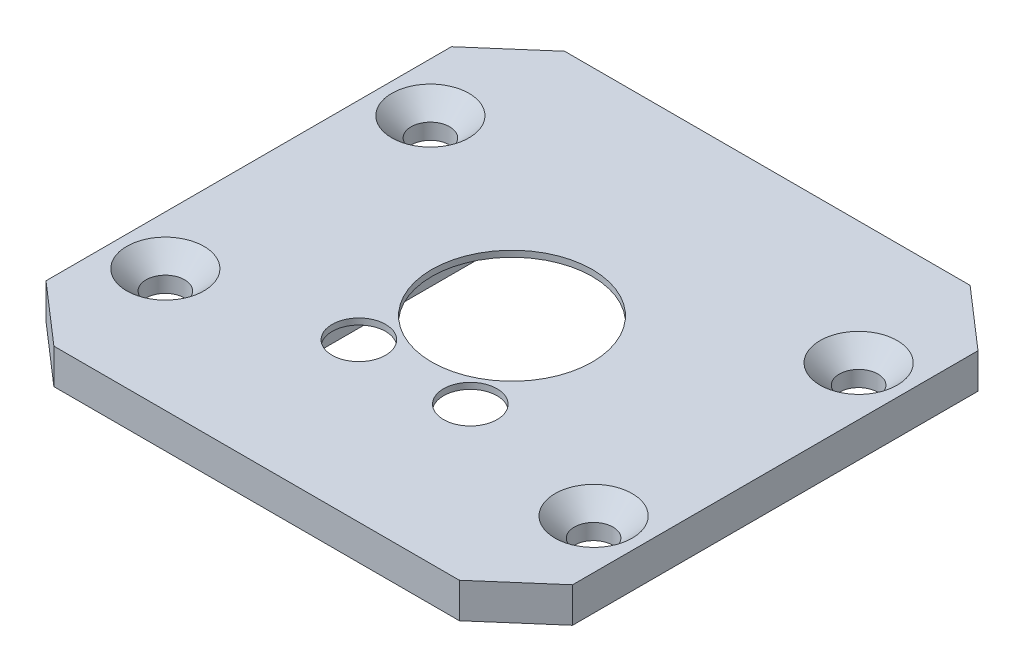
from build123d import *

# Parameters (mm, degrees)
BOSS_EXTRUDE1_DEPTH                             = 2
CSK_FOR_M2_FLAT_HEAD_MACHINE_SCREW1_D           = 2.2
CSK_FOR_M2_FLAT_HEAD_MACHINE_SCREW1_DEPTH       = 4
CSK_FOR_M2_FLAT_HEAD_MACHINE_SCREW1_CSINK_D     = 4.4
CSK_FOR_M2_FLAT_HEAD_MACHINE_SCREW1_CSINK_ANGLE = 90
CSK_FOR_M2_FLAT_HEAD_MACHINE_SCREW1_TIP         = 0.660946681
SKETCH9_W                                       = 11.5
SKETCH9_H                                       = 17.1
CUT_EXTRUDE1_DEPTH                              = 1.651
SKETCH11_R                                      = 4.572
SKETCH11_R_2                                    = 1.524
CUT_EXTRUDE2_DEPTH                              = 31.275155769


with BuildPart() as part:
    # Sketch1 → Boss-Extrude1 (new body)
    with BuildSketch(Plane(origin=(0, 0, 0), x_dir=(1, 0, 0), z_dir=(0, 1, 0))):
        Polygon((-10.147286186, 19.79756588), (-10.147286186, -3.30243412), (-6.697286186, -6.30243412), (16.402713814, -6.30243412), (19.852713814, -3.30243412), (19.852713814, 19.79756588), (16.402713814, 22.79756588), (-6.697286186, 22.79756588), align=None)
    extrude(amount=BOSS_EXTRUDE1_DEPTH)

    # CSK for M2 Flat Head Machine Screw1
    with Locations(Plane(origin=(0, 2, 0), x_dir=(1, 0, 0), z_dir=(0, 1, 0))):
        with Locations((-7.347286186, 15.79756588), (17.052713814, 15.79756588), (17.052713814, 0.69756588), (-7.347286186, 0.69756588)):
            CounterSinkHole(CSK_FOR_M2_FLAT_HEAD_MACHINE_SCREW1_D / 2, CSK_FOR_M2_FLAT_HEAD_MACHINE_SCREW1_CSINK_D / 2, depth=CSK_FOR_M2_FLAT_HEAD_MACHINE_SCREW1_DEPTH, counter_sink_angle=CSK_FOR_M2_FLAT_HEAD_MACHINE_SCREW1_CSINK_ANGLE)
            with Locations((0, 0, -(CSK_FOR_M2_FLAT_HEAD_MACHINE_SCREW1_DEPTH + CSK_FOR_M2_FLAT_HEAD_MACHINE_SCREW1_TIP / 2))):  # 118° drill point
                Cone(0, CSK_FOR_M2_FLAT_HEAD_MACHINE_SCREW1_D / 2, CSK_FOR_M2_FLAT_HEAD_MACHINE_SCREW1_TIP, mode=Mode.SUBTRACT)

    # Sketch9 → Cut-Extrude1 (cut)
    with BuildSketch(Plane(origin=(0, 0, 0), x_dir=(1, 0, 0), z_dir=(0, 1, 0))):
        with Locations((4.852713814, 8.24756588)):
            Rectangle(SKETCH9_W, SKETCH9_H)
    extrude(amount=CUT_EXTRUDE1_DEPTH, mode=Mode.SUBTRACT)

    # Sketch11 → Cut-Extrude2 (cut, through all)
    with BuildSketch(Plane.XZ.offset(-1.651)):
        with Locations(Location((4.852713814, -8.24756588, 0), (0, 0, 270))):
            Circle(SKETCH11_R)
        with Locations(Location((8.027713814, -2.69756588, 0), (0, 0, 270))):
            Circle(SKETCH11_R_2)
        with Locations(Location((1.677713814, -2.69756588, 0), (0, 0, 270))):
            Circle(SKETCH11_R_2)
    extrude(amount=-CUT_EXTRUDE2_DEPTH, mode=Mode.SUBTRACT)


solid = part.part
